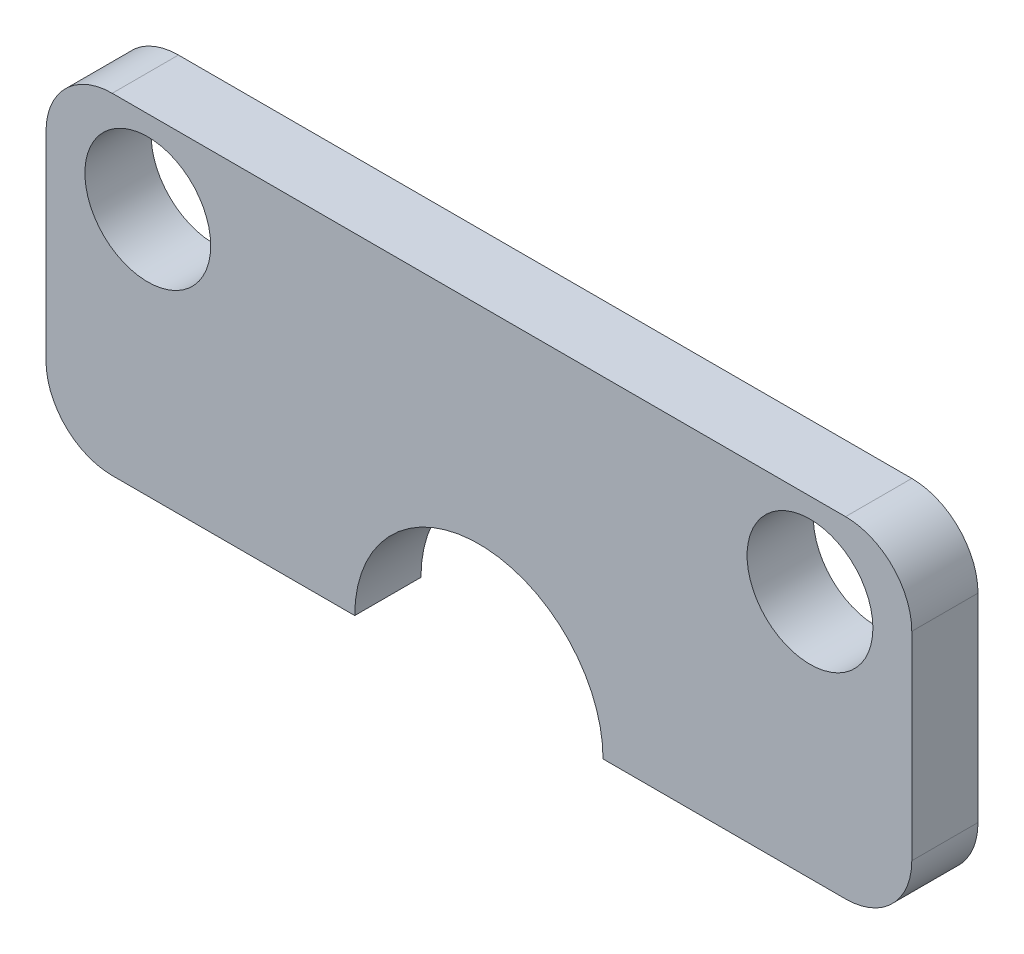
from build123d import *

# Parameters (mm, degrees)
SKETCH1_R           = 2.413
BOSS_EXTRUDE1_DEPTH = 2.54
FILLET1_R           = 2.54


with BuildPart() as part:
    # Sketch1 → Boss-Extrude1 (new body)
    # profile 1 of 2: a face of its own
    with BuildSketch(Plane.XY):
        with BuildLine():
            Line((-367.293338715, 162.140585859), (-357.133338715, 162.140585859))
            ThreePointArc((-357.133338715, 162.140585859), (-350.689077681, 168.584846892), (-344.244816647, 162.140585859))
            Line((-344.244816647, 162.140585859), (-334.084816647, 162.140585859))
            Line((-334.084816647, 162.140585859), (-334.084816647, 174.840585859))
            Line((-334.084816647, 174.840585859), (-367.293338715, 174.840585859))
            Line((-367.293338715, 174.840585859), (-367.293338715, 162.140585859))
        make_face()
        with Locations((-363.389077681, 171.665585859)):
            Circle(SKETCH1_R, mode=Mode.SUBTRACT)
        with Locations((-337.989077681, 171.665585859)):
            Circle(SKETCH1_R, mode=Mode.SUBTRACT)
    # profile 2 of 2: a face of its own
    with BuildSketch(Plane.XY):
        with BuildLine():
            ThreePointArc((-344.244816647, 162.140585859), (-350.689077681, 168.584846892), (-357.133338715, 162.140585859))
            Line((-357.133338715, 162.140585859), (-355.451577681, 162.140585859))
            ThreePointArc((-355.451577681, 162.140585859), (-350.689077681, 166.903085859), (-345.926577681, 162.140585859))
            Line((-345.926577681, 162.140585859), (-344.244816647, 162.140585859))
        make_face()
    extrude(amount=BOSS_EXTRUDE1_DEPTH)

    # Fillet1
    fillet1_edges = [part.edges().sort_by_distance(p)[0] for p in [
        (-367.293338715, 162.140585859, 1.27),
        (-367.293338715, 174.840585859, 1.27),
        (-334.084816647, 174.840585859, 1.27),
        (-334.084816647, 162.140585859, 1.27),
    ]]
    fillet(fillet1_edges, radius=FILLET1_R)


solid = part.part
